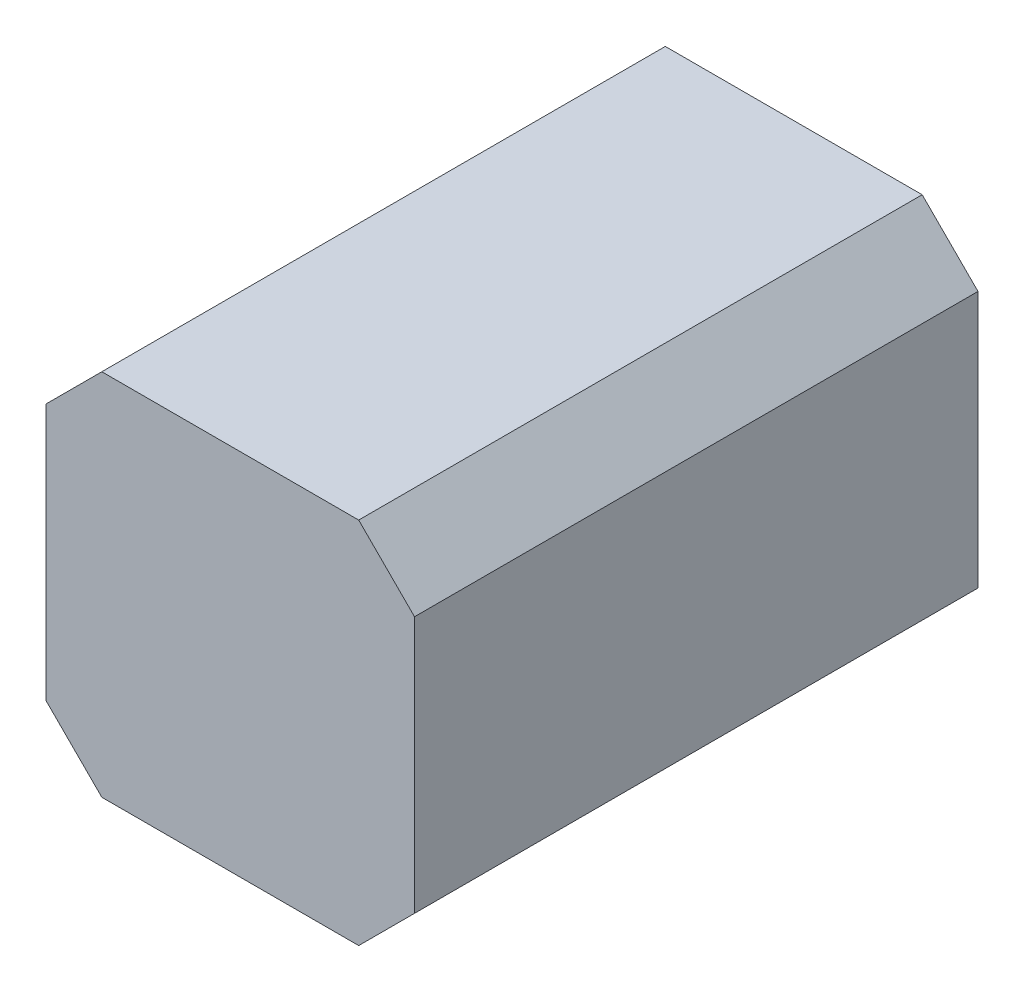
from build123d import *

# Parameters (mm, degrees)
EXTRUDE_2_DEPTH = 237
SCALE_1_SCALE   = 0.761290323


with BuildPart() as part:
    # 草图3 → 凸台-拉伸2 (new body)
    with BuildSketch(Plane.XY):
        Polygon((-77.5, -54.021861301), (-54.021861301, -77.5), (54.021861301, -77.5), (77.5, -54.021861301), (77.5, 54.021861301), (54.021861301, 77.5), (-54.021861301, 77.5), (-77.5, 54.021861301), align=None)
    extrude(amount=EXTRUDE_2_DEPTH)


with BuildPart() as part_1:
    # 缩放比例1: scaled about (0, 0, 0)
    add(part.part.scale(SCALE_1_SCALE))


solid = part_1.part
